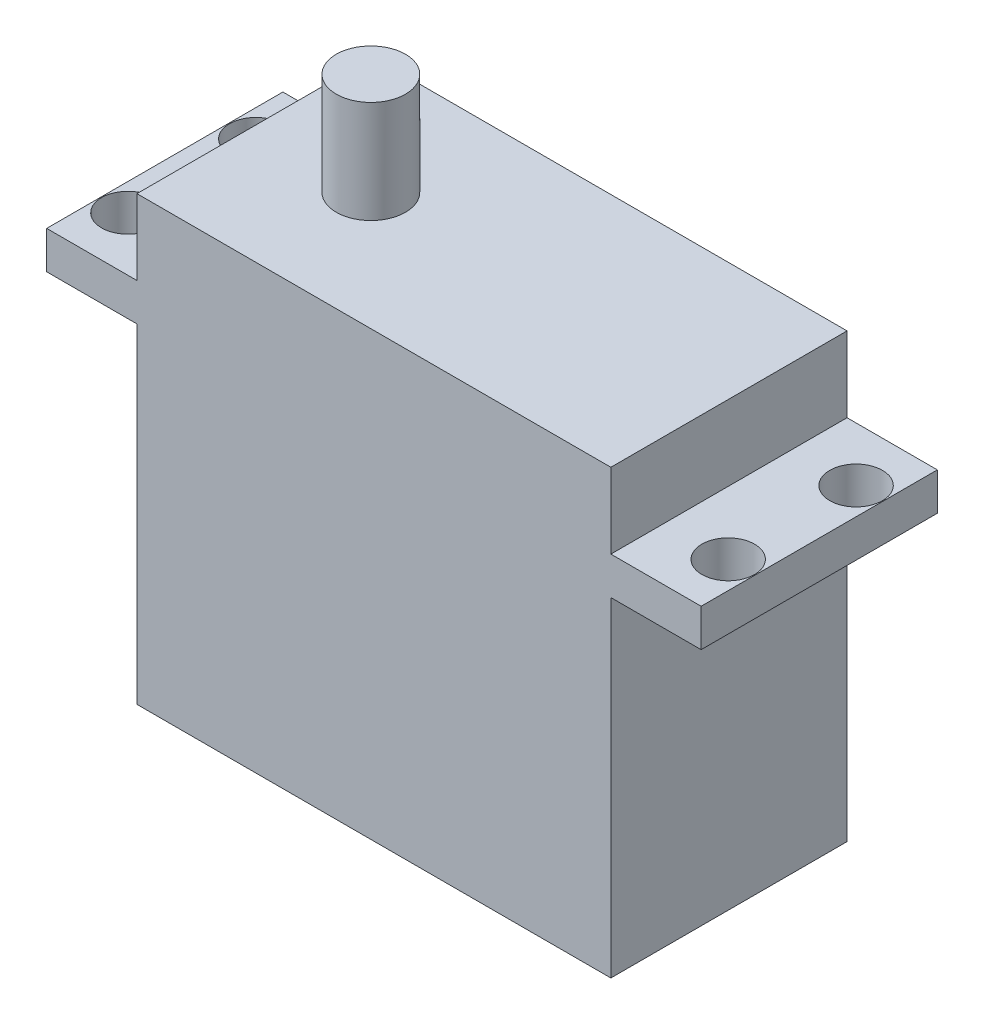
from build123d import *

# Parameters (mm, degrees)
SKETCH1_W           = 40.005
SKETCH1_H           = 19.939
BOSS_EXTRUDE1_DEPTH = 37.338
SKETCH2_W           = 19.939
SKETCH2_H           = 3.175
BOSS_EXTRUDE2_DEPTH = 7.62
SKETCH3_R           = 2.2225
CUT_EXTRUDE1_DEPTH  = 61.215948801
SKETCH4_R           = 2.921
BOSS_EXTRUDE3_DEPTH = 8.636


with BuildPart() as part:
    # Sketch1 → Boss-Extrude1 (new body)
    with BuildSketch(Plane(origin=(0, 0, 0), x_dir=(1, 0, 0), z_dir=(0, 1, 0))):
        with Locations((20.0025, 9.9695)):
            Rectangle(SKETCH1_W, SKETCH1_H)
    extrude(amount=BOSS_EXTRUDE1_DEPTH)

    # Sketch2 → Boss-Extrude2 (add)
    with BuildSketch(Plane(origin=(40.005, 0, 0), x_dir=(0, 0, -1), z_dir=(1, 0, 0))):
        with Locations((9.9695, 29.4005)):
            Rectangle(SKETCH2_W, SKETCH2_H)
    boss_extrude2 = extrude(amount=BOSS_EXTRUDE2_DEPTH)

    # Sketch3 → Cut-Extrude1 (cut, through all)
    with BuildSketch(Plane(origin=(0, 30.988, 0), x_dir=(1, 0, 0), z_dir=(0, 1, 0))):
        with Locations(Location((45.339, 15.367, 0), (0, 0, 270))):
            Circle(SKETCH3_R)
        with Locations(Location((45.339, 4.572, 0), (0, 0, 270))):
            Circle(SKETCH3_R)
    cut_extrude1 = extrude(amount=-CUT_EXTRUDE1_DEPTH, mode=Mode.SUBTRACT)

    # Mirror1: Boss-Extrude2, Cut-Extrude1 across plane
    add(boss_extrude2.mirror(Plane(origin=(20.0025, 0, 0), x_dir=(0, 0, 1), z_dir=(1, 0, 0))))
    add(cut_extrude1.mirror(Plane(origin=(20.0025, 0, 0), x_dir=(0, 0, 1), z_dir=(1, 0, 0))), mode=Mode.SUBTRACT)

    # Sketch4 → Boss-Extrude3 (add)
    with BuildSketch(Plane(origin=(0, 37.338, 0), x_dir=(1, 0, 0), z_dir=(0, 1, 0))):
        with Locations(Location((9.779, 9.9695, 0), (0, 0, 90))):
            Circle(SKETCH4_R)
    extrude(amount=BOSS_EXTRUDE3_DEPTH)


solid = part.part
